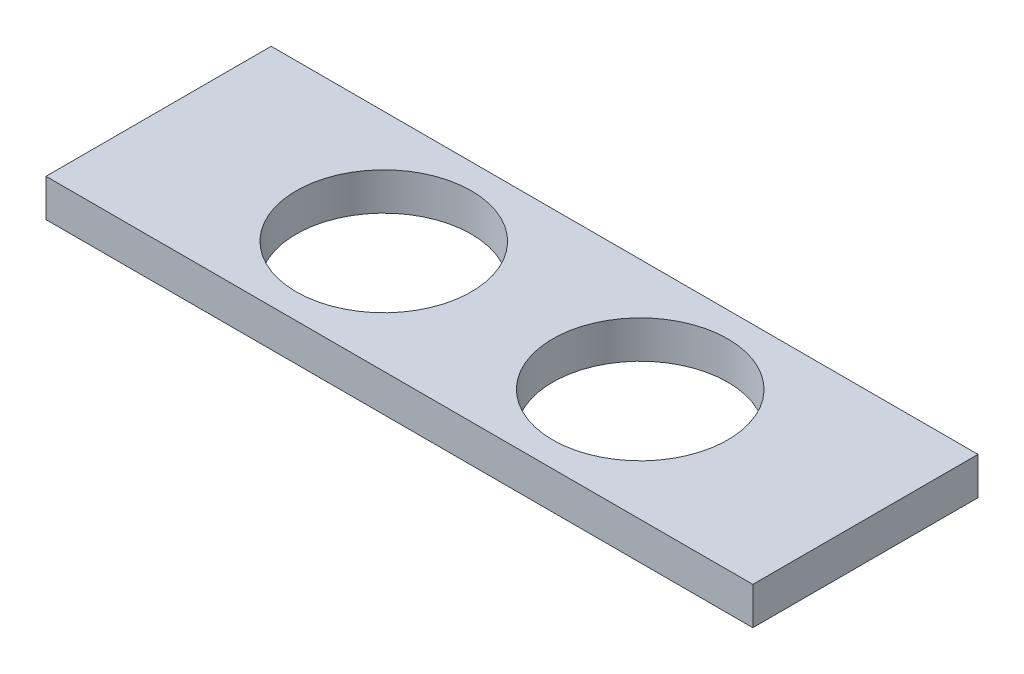
from build123d import *

# Parameters (mm, degrees)
SKETCH1_W           = 56.5
SKETCH1_H           = 18
SKETCH1_R           = 7
BOSS_EXTRUDE2_DEPTH = 3


with BuildPart() as part:
    # Sketch1 → Boss-Extrude2 (new body)
    with BuildSketch(Plane(origin=(0, 0, 0), x_dir=(1, 0, 0), z_dir=(0, 1, 0))):
        with Locations((-2.25, 0)):
            Rectangle(SKETCH1_W, SKETCH1_H)
        with Locations(Location((-12.5, 0, 0), (0, 0, 270))):
            Circle(SKETCH1_R, mode=Mode.SUBTRACT)
        with Locations(Location((8, 0, 0), (0, 0, 270))):
            Circle(SKETCH1_R, mode=Mode.SUBTRACT)
    extrude(amount=BOSS_EXTRUDE2_DEPTH)


solid = part.part
